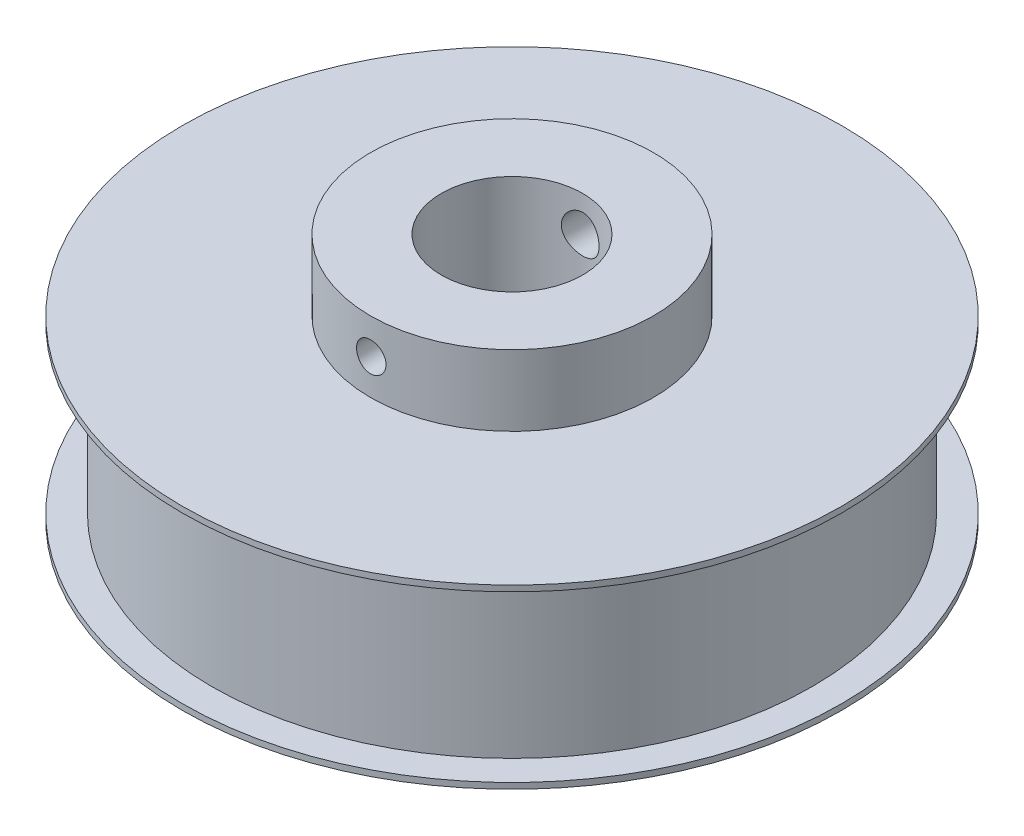
from build123d import *

# Parameters (mm, degrees)
CROQUIS1_R                 = 25.465
SALIENTE_EXTRUIR1_DEPTH    = 7.5
CROQUIS2_R                 = 27.965
SALIENTE_EXTRUIR2_DEPTH    = 0.5
SALIENTE_EXTRUIR3_START    = -14.5
CROQUIS2_2_R               = 27.965
SALIENTE_EXTRUIR3_DEPTH    = 0.5
CROQUIS3_R                 = 19
SALIENTE_EXTRUIR4_DEPTH    = 21
CORTAR_EXTRUIR1_DEPTH      = 45.545846608
CORTAR_EXTRUIR1_DEPTH_BACK = 45.545846608
CROQUIS4_R                 = 6
CORTAR_EXTRUIR2_START      = -6
CROQUIS5_R                 = 19
CROQUIS5_R_2               = 12
CORTAR_EXTRUIR2_DEPTH      = 6
TALADRO_ROSCADO_M31_REACH  = 60.109
TALADRO_ROSCADO_M31_BORE_R = 1.25
CROQUIS10_W                = 1.6
CROQUIS10_H                = 12


with BuildPart() as part:
    # Croquis1 → Saliente-Extruir1 (new, symmetric)
    with BuildSketch(Plane(origin=(0, 0, 0), x_dir=(-1, 0, 0), z_dir=(0, 1, 0))):
        with Locations(Location((0, 0, 0), (0, 0, 90))):
            Circle(CROQUIS1_R)
    extrude(amount=SALIENTE_EXTRUIR1_DEPTH, both=True)

    # Croquis2 → Saliente-Extruir2 (add)
    with BuildSketch(Plane(origin=(0, 7.5, 0), x_dir=(-1, 0, 0), z_dir=(0, 1, 0))):
        with Locations(Location((0, 0, 0), (0, 0, 90))):
            Circle(CROQUIS2_R)
    extrude(amount=-SALIENTE_EXTRUIR2_DEPTH)

    # Croquis2<2> → Saliente-Extruir3 (add)
    with BuildSketch(Plane(origin=(0, 7.5, 0), x_dir=(-1, 0, 0), z_dir=(0, 1, 0)).offset(SALIENTE_EXTRUIR3_START)):
        with Locations(Location((0, 0, 0), (0, 0, 90))):
            Circle(CROQUIS2_2_R)
    extrude(amount=-SALIENTE_EXTRUIR3_DEPTH)

    # Croquis3 → Saliente-Extruir4 (add)
    with BuildSketch(Plane(origin=(0, -7.5, 0), x_dir=(-1, 0, 0), z_dir=(0, 1, 0))):
        with Locations(Location((0, 0, 0), (0, 0, 270))):
            Circle(CROQUIS3_R)
    extrude(amount=SALIENTE_EXTRUIR4_DEPTH)

    # Croquis4 → Cortar-Extruir1 (cut, two sides: drawn at the far end of the back side and taken through both)
    with BuildSketch(Plane(origin=(0, -7, 0), x_dir=(-1, 0, 0), z_dir=(0, 1, 0)).offset(-CORTAR_EXTRUIR1_DEPTH_BACK)):
        with Locations(Location((0, 0, 0), (0, 0, 90))):
            Circle(CROQUIS4_R)
    extrude(amount=CORTAR_EXTRUIR1_DEPTH + CORTAR_EXTRUIR1_DEPTH_BACK, mode=Mode.SUBTRACT)

    # Croquis5 → Cortar-Extruir2 (cut)
    with BuildSketch(Plane(origin=(0, 13.5, 0), x_dir=(-1, 0, 0), z_dir=(0, 1, 0)).offset(CORTAR_EXTRUIR2_START)):
        Circle(CROQUIS5_R)
        with Locations(Location((0, 0, 0), (0, 0, 90))):
            Circle(CROQUIS5_R_2, mode=Mode.SUBTRACT)
    extrude(amount=CORTAR_EXTRUIR2_DEPTH, mode=Mode.SUBTRACT)

    # Taladro roscado M31 bore → Taladro roscado M31 (cut, up to next)
    with BuildSketch(Plane(origin=(-12, 0, 12), x_dir=(0, 1, 0), z_dir=(0, 0, 1)), mode=Mode.PRIVATE) as taladro_roscado_m31_sk1:
        with Locations((10.5, -12)):
            Circle(TALADRO_ROSCADO_M31_BORE_R)
    taladro_roscado_m31_tool1 = extrude(taladro_roscado_m31_sk1.sketch, amount=-TALADRO_ROSCADO_M31_REACH, mode=Mode.PRIVATE) & part.part
    add(taladro_roscado_m31_tool1.solids().sort_by_distance((0, 10.5, 12))[0], mode=Mode.SUBTRACT)

    # Croquis10 → Taladro de margen para M32 (revolve, cut)
    with BuildSketch(Plane(origin=(0, 10.5, 0), x_dir=(0, -1, 0), z_dir=(1, 0, 0))):
        with Locations((0.8, 6)):
            Rectangle(CROQUIS10_W, CROQUIS10_H)
    revolve(axis=Axis((0, 10.5, 6.35), (0, 0, -1)), mode=Mode.SUBTRACT)


solid = part.part
